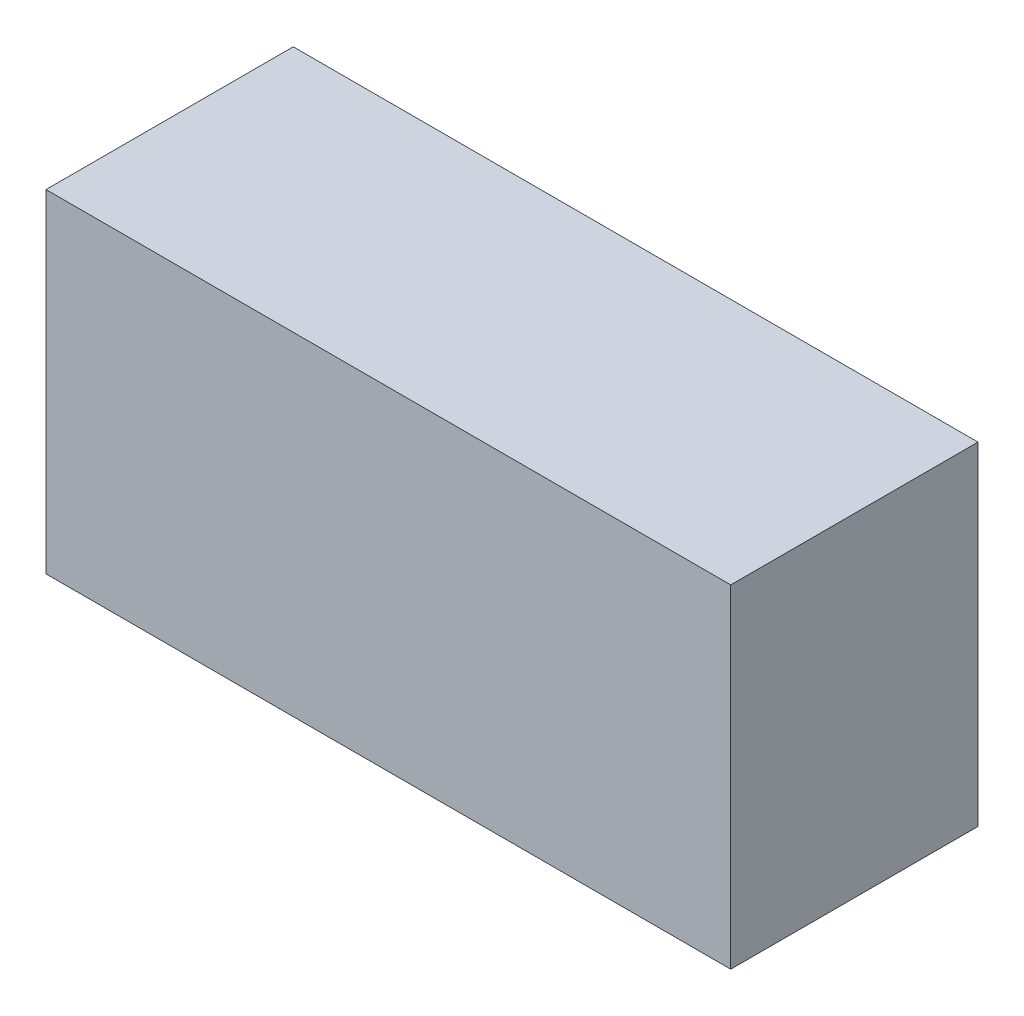
from build123d import *

# Parameters (mm, degrees)
SKETCH1_W           = 72
SKETCH1_H           = 26
BOSS_EXTRUDE1_DEPTH = 35
SKETCH2_W           = 0.448717948
SKETCH2_H           = 3.653846154
BOSS_EXTRUDE2_DEPTH = 1


with BuildPart() as part:
    # Sketch1 → Boss-Extrude1 (new body)
    with BuildSketch(Plane(origin=(0, 0, 0), x_dir=(1, 0, 0), z_dir=(0, 1, 0))):
        Rectangle(SKETCH1_W, SKETCH1_H)
    extrude(amount=BOSS_EXTRUDE1_DEPTH)

    # Sketch2 → Boss-Extrude2 (add)
    # profile 1 of 13: a face of its own
    with BuildSketch(Plane(origin=(0, 22.5, -13), x_dir=(1, 0, 0), z_dir=(0, 0, 1))):
        with BuildLine():
            Line((-20.801282051, -8.732744121), (-19.825721154, -8.732744121))
            add(Edge.make_bspline(
                [(-19.825721154, -8.732744121), (-19.777965432, -8.732497002), (-19.685402957, -8.732018023), (-19.55081399, -8.724416976), (-19.424708804, -8.714312102), (-19.307310244, -8.697361721), (-19.197854414, -8.679786411), (-19.097452521, -8.653990064), (-19.005263574, -8.625497059), (-18.894563518, -8.581656703), (-18.768959137, -8.513572079), (-18.633957929, -8.412596111), (-18.516606641, -8.291534079), (-18.416823262, -8.153574345), (-18.336744978, -8.001803004), (-18.279544786, -7.839485465), (-18.242797204, -7.669352527), (-18.239065454, -7.552710667), (-18.237179487, -7.493761749)],
                knots=[0, 0, 0, 0, 1.00128172, 1.940733171, 2.826250472, 3.653024905, 4.427672124, 5.149348099, 5.824709082, 6.450061444, 7.643590664, 8.808605388, 9.972104426, 11.165284501, 12.367876273, 13.557044126, 14.765369432, 16, 16, 16, 16], degree=3))
            add(Edge.make_bspline(
                [(-18.237179487, -7.493761749), (-18.238719971, -7.438536761), (-18.241747167, -7.330014451), (-18.271320427, -7.171820125), (-18.315960546, -7.020758725), (-18.380378948, -6.878286023), (-18.462517825, -6.745653922), (-18.56245211, -6.625124791), (-18.680946784, -6.519065009), (-18.769913239, -6.460041231), (-18.815104167, -6.430059826)],
                knots=[0, 0, 0, 0, 1.044356178, 2.052258378, 3.035953355, 4.020338374, 5.002448483, 5.980768927, 6.974322109, 8, 8, 8, 8], degree=3))
            add(Edge.make_bspline(
                [(-18.815104167, -6.430059826), (-18.758299525, -6.408262462), (-18.649618173, -6.366558706), (-18.499865057, -6.292541381), (-18.370799058, -6.212653289), (-18.260756867, -6.12630887), (-18.168549286, -6.030688738), (-18.08640707, -5.928311111), (-18.016695497, -5.815610524), (-17.957215972, -5.695029146), (-17.910098737, -5.56720553), (-17.877392824, -5.43309595), (-17.85665063, -5.294219381), (-17.85393821, -5.199831624), (-17.852564103, -5.152014954)],
                knots=[0, 0, 0, 0, 1.272200328, 2.434034374, 3.488177493, 4.442517805, 5.351202203, 6.260825393, 7.183200622, 8.11705787, 9.069326169, 10.026320267, 11.000137371, 12, 12, 12, 12], degree=3))
            add(Edge.make_bspline(
                [(-17.852564103, -5.152014954), (-17.853959731, -5.103205218), (-17.856705669, -5.007170695), (-17.876960858, -4.866090772), (-17.911266613, -4.731273681), (-17.958485239, -4.601822025), (-18.020037095, -4.478493963), (-18.094398133, -4.360320272), (-18.183647062, -4.249052306), (-18.284150135, -4.143075428), (-18.396282649, -4.046164152), (-18.519843907, -3.962881788), (-18.651667161, -3.890947386), (-18.793557574, -3.833116162), (-18.944508337, -3.787844891), (-19.104554812, -3.756544409), (-19.273606118, -3.735369437), (-19.389621732, -3.733634075), (-19.44911859, -3.732744121)],
                knots=[0, 0, 0, 0, 0.978522333, 1.925270105, 2.85076145, 3.763600118, 4.682725947, 5.609499657, 6.557784645, 7.537954401, 8.534920712, 9.522742111, 10.520247711, 11.5409147, 12.58930695, 13.675078472, 14.807699069, 16, 16, 16, 16], degree=3))
            Line((-19.44911859, -3.732744121), (-20.801282051, -3.732744121))
            Line((-20.801282051, -3.732744121), (-20.801282051, -8.732744121))
        make_face()
        with BuildLine():
            Line((-20.352564103, -8.219923608), (-20.352564103, -6.617359506))
            Line((-20.352564103, -6.617359506), (-20.051081731, -6.617359506))
            add(Edge.make_bspline(
                [(-20.051081731, -6.617359506), (-20.007011626, -6.61792607), (-19.921859203, -6.619020787), (-19.79821736, -6.622255472), (-19.683735472, -6.630916093), (-19.578019079, -6.640076146), (-19.481776658, -6.654180692), (-19.39468628, -6.671440877), (-19.31596474, -6.689534948), (-19.225225478, -6.72039563), (-19.122311596, -6.765527064), (-19.013370616, -6.837282489), (-18.915318838, -6.920359757), (-18.83443178, -7.01890238), (-18.767090369, -7.1253195), (-18.721752011, -7.240404674), (-18.690140423, -7.360192035), (-18.687326253, -7.442803595), (-18.685897436, -7.484747326)],
                knots=[0, 0, 0, 0, 1.156584208, 2.234756387, 3.244705828, 4.168772894, 5.018724976, 5.795346628, 6.498686023, 7.135894168, 8.308330183, 9.43588092, 10.547699294, 11.667188675, 12.76860303, 13.837480448, 14.902040606, 16, 16, 16, 16], degree=3))
            add(Edge.make_bspline(
                [(-18.685897436, -7.484747326), (-18.686594293, -7.512514992), (-18.687961254, -7.5669843), (-18.700848136, -7.646342954), (-18.718631881, -7.72186103), (-18.747961705, -7.791502695), (-18.782709966, -7.857713352), (-18.827248936, -7.918401534), (-18.878606466, -7.975211289), (-18.93848291, -8.026619886), (-19.006633504, -8.073115995), (-19.085217099, -8.111821785), (-19.172097197, -8.14621915), (-19.269085521, -8.172293157), (-19.374250151, -8.194929547), (-19.489195527, -8.209203929), (-19.613228908, -8.218374017), (-19.699166909, -8.219395557), (-19.743589744, -8.219923608)],
                knots=[0, 0, 0, 0, 0.911412742, 1.787835618, 2.63643285, 3.453173233, 4.262886967, 5.08783453, 5.918594724, 6.773969545, 7.67442701, 8.62112486, 9.645634318, 10.739428598, 11.916091468, 13.177237585, 14.540865421, 16, 16, 16, 16], degree=3))
            Line((-19.743589744, -8.219923608), (-20.352564103, -8.219923608))
        make_face(mode=Mode.SUBTRACT)
        with BuildLine():
            Line((-20.352564103, -6.104538993), (-20.352564103, -4.245564634))
            Line((-20.352564103, -4.245564634), (-19.713541667, -4.245564634))
            add(Edge.make_bspline(
                [(-19.713541667, -4.245564634), (-19.667804917, -4.246165559), (-19.57965336, -4.247323763), (-19.452280831, -4.250072021), (-19.334853106, -4.260268048), (-19.22639248, -4.27004337), (-19.127400787, -4.286013389), (-19.036915165, -4.301477878), (-18.957002347, -4.324234638), (-18.863499735, -4.355548341), (-18.758918004, -4.40559179), (-18.644709819, -4.479184969), (-18.544116164, -4.568826883), (-18.458769497, -4.672044459), (-18.387807485, -4.783115208), (-18.338715787, -4.902257738), (-18.306907162, -5.025492494), (-18.303160863, -5.1097559), (-18.301282051, -5.152014954)],
                knots=[0, 0, 0, 0, 1.16016216, 2.236059617, 3.229676189, 4.14889023, 4.996733752, 5.772278665, 6.474820656, 7.101410824, 8.271817372, 9.403828207, 10.537358096, 11.673541442, 12.791884111, 13.865947414, 14.929748409, 16, 16, 16, 16], degree=3))
            add(Edge.make_bspline(
                [(-18.301282051, -5.152014954), (-18.301665574, -5.178437975), (-18.302426434, -5.23085781), (-18.314386394, -5.307822638), (-18.330983759, -5.382745713), (-18.355443612, -5.454609329), (-18.385033384, -5.524650966), (-18.424069833, -5.590591599), (-18.468102658, -5.655238215), (-18.536302844, -5.737928395), (-18.636853318, -5.832051394), (-18.779789365, -5.92305217), (-18.94140392, -5.997630142), (-19.058897301, -6.029157977), (-19.119591346, -6.045444442)],
                knots=[0, 0, 0, 0, 0.723354195, 1.435040621, 2.129761981, 2.824182007, 3.512608497, 4.209435533, 4.920062464, 5.654614313, 7.143585817, 8.671381114, 10.280521501, 12, 12, 12, 12], degree=3))
            add(Edge.make_bspline(
                [(-19.119591346, -6.045444442), (-19.143918603, -6.050380608), (-19.196665114, -6.061083234), (-19.282676381, -6.072373573), (-19.381199742, -6.082501375), (-19.491814094, -6.089796221), (-19.614959362, -6.097627112), (-19.750595985, -6.100564173), (-19.898819854, -6.104149012), (-20.001666226, -6.104405674), (-20.055088141, -6.104538993)],
                knots=[0, 0, 0, 0, 0.634452549, 1.375623993, 2.216454381, 3.166361212, 4.209414599, 5.370755378, 6.634280627, 8, 8, 8, 8], degree=3))
            Line((-20.055088141, -6.104538993), (-20.352564103, -6.104538993))
        make_face(mode=Mode.SUBTRACT)
    # profile 2 of 13: a face of its own
    with BuildSketch(Plane(origin=(0, 22.5, -13), x_dir=(1, 0, 0), z_dir=(0, 0, 1))):
        with BuildLine():
            Line((-13.237179487, -7.386590275), (-13.237179487, -3.732744121))
            Line((-13.237179487, -3.732744121), (-13.685897436, -3.732744121))
            Line((-13.685897436, -3.732744121), (-13.685897436, -4.364755339))
            add(Edge.make_bspline(
                [(-13.685897436, -4.364755339), (-13.736564258, -4.307634786), (-13.835588238, -4.195997537), (-13.999392659, -4.049253034), (-14.174459716, -3.92944337), (-14.357806814, -3.832193631), (-14.550853122, -3.758884938), (-14.752464887, -3.707239872), (-14.962484365, -3.673644023), (-15.105706266, -3.670324006), (-15.178285256, -3.668641557)],
                knots=[0, 0, 0, 0, 1.074235403, 2.099501444, 3.086304576, 4.053325556, 5.01427503, 5.985443889, 6.979105517, 8, 8, 8, 8], degree=3))
            add(Edge.make_bspline(
                [(-15.178285256, -3.668641557), (-15.24281108, -3.670393227), (-15.370058861, -3.673847597), (-15.557240736, -3.700655068), (-15.737381831, -3.743683377), (-15.910596954, -3.803598605), (-16.07571243, -3.882664006), (-16.233658642, -3.978344062), (-16.384804208, -4.09116775), (-16.526274655, -4.220651516), (-16.656713913, -4.361140552), (-16.77083509, -4.511421179), (-16.867556502, -4.669429298), (-16.94704418, -4.835120498), (-17.008555914, -5.00837366), (-17.051351437, -5.189069927), (-17.07813002, -5.376908632), (-17.08158264, -5.504822782), (-17.083333333, -5.569683224)],
                knots=[0, 0, 0, 0, 1.034036272, 2.039165313, 3.024406509, 3.999331371, 4.971254918, 5.953351348, 6.95522652, 7.989525907, 9.023492927, 10.024309745, 11.009187477, 11.988246066, 12.964946762, 13.950187958, 14.960617622, 16, 16, 16, 16], degree=3))
            add(Edge.make_bspline(
                [(-17.083333333, -5.569683224), (-17.08154381, -5.633203071), (-17.07800602, -5.758778382), (-17.051637976, -5.943458324), (-17.007331225, -6.121355998), (-16.945033841, -6.291812406), (-16.865503893, -6.455514031), (-16.767119091, -6.61118007), (-16.653039039, -6.761191775), (-16.521205715, -6.900738535), (-16.378465519, -7.029171783), (-16.226474309, -7.142269654), (-16.067127263, -7.237704395), (-15.900104868, -7.315283562), (-15.72658979, -7.37693269), (-15.545263928, -7.419908069), (-15.356951879, -7.445170712), (-15.229109663, -7.448834443), (-15.164262821, -7.450692839)],
                knots=[0, 0, 0, 0, 1.02050356, 2.017480486, 2.990790918, 3.96161403, 4.928589988, 5.909588639, 6.91611943, 7.952353252, 8.989586576, 9.99823133, 10.991940466, 11.968822692, 12.952985106, 13.945868367, 14.958059758, 16, 16, 16, 16], degree=3))
            add(Edge.make_bspline(
                [(-15.164262821, -7.450692839), (-15.089690105, -7.44864662), (-14.94345653, -7.444634081), (-14.72926166, -7.410956751), (-14.526537561, -7.354588066), (-14.333528326, -7.27765062), (-14.152946359, -7.17404326), (-13.983055652, -7.045846169), (-13.82587202, -6.889951432), (-13.733362755, -6.771357547), (-13.685897436, -6.710508544)],
                knots=[0, 0, 0, 0, 1.038908319, 2.037250181, 3.012632028, 3.966567879, 4.9252131, 5.905168122, 6.925168603, 8, 8, 8, 8], degree=3))
            Line((-13.685897436, -6.710508544), (-13.685897436, -7.386590275))
            Line((-13.685897436, -7.386590275), (-13.237179487, -7.386590275))
        make_face()
        with BuildLine():
            add(Edge.make_bspline(
                [(-15.158253205, -7.00197489), (-15.223843744, -6.99963915), (-15.353309036, -6.99502877), (-15.543391739, -6.959095155), (-15.72519348, -6.899152848), (-15.898418617, -6.817647231), (-16.058284717, -6.713241051), (-16.203530503, -6.590138068), (-16.33021861, -6.446830036), (-16.43733697, -6.286609481), (-16.52626506, -6.115875015), (-16.587632349, -5.936096795), (-16.628392781, -5.752133863), (-16.632535783, -5.627324128), (-16.634615385, -5.564675211)],
                knots=[0, 0, 0, 0, 1.031179624, 2.035384561, 3.030098214, 4.035455833, 5.037557836, 6.024646278, 7.02156144, 8.035264006, 9.049836703, 10.039645228, 11.015989397, 12, 12, 12, 12], degree=3))
            add(Edge.make_bspline(
                [(-16.634615385, -5.564675211), (-16.631915805, -5.502416002), (-16.626527226, -5.37814162), (-16.588884569, -5.193896772), (-16.522810796, -5.015291463), (-16.43582797, -4.842356149), (-16.32702343, -4.680940522), (-16.200585368, -4.534986384), (-16.054602577, -4.409985773), (-15.893328758, -4.305284495), (-15.721262477, -4.22106073), (-15.540250042, -4.161657441), (-15.353446442, -4.124150725), (-15.226202925, -4.11963086), (-15.162259615, -4.117359506)],
                knots=[0, 0, 0, 0, 0.979235476, 1.954632679, 2.943119654, 3.967171814, 4.992637064, 5.997548408, 6.995574264, 8.005058949, 9.015076297, 9.999929117, 10.994910263, 12, 12, 12, 12], degree=3))
            add(Edge.make_bspline(
                [(-15.162259615, -4.117359506), (-15.097337074, -4.119722612), (-14.968540978, -4.124410644), (-14.777801023, -4.160592075), (-14.593040475, -4.221278678), (-14.415763999, -4.303915907), (-14.250896516, -4.406365971), (-14.103614019, -4.526838083), (-13.976376107, -4.664801168), (-13.871616656, -4.819430861), (-13.787915269, -4.987081428), (-13.728648339, -5.166148512), (-13.692651692, -5.355568031), (-13.688179985, -5.485388499), (-13.685897436, -5.551654377)],
                knots=[0, 0, 0, 0, 1.017730373, 2.019016736, 3.032373701, 4.060729657, 5.079187105, 6.068726676, 7.03591854, 8.011858086, 8.988317194, 9.965225429, 10.961364673, 12, 12, 12, 12], degree=3))
            add(Edge.make_bspline(
                [(-13.685897436, -5.551654377), (-13.687268395, -5.602136973), (-13.689966877, -5.701502697), (-13.710581667, -5.847399429), (-13.743375552, -5.987018018), (-13.789580242, -6.120511283), (-13.850297414, -6.247118943), (-13.923450707, -6.367833429), (-14.010540604, -6.481530299), (-14.108916737, -6.588065568), (-14.217812495, -6.684750345), (-14.33360902, -6.769967496), (-14.45601497, -6.842084655), (-14.584944422, -6.899797245), (-14.719404352, -6.946814245), (-14.860683535, -6.977868161), (-15.007358133, -6.999259517), (-15.107425259, -7.001060236), (-15.158253205, -7.00197489)],
                knots=[0, 0, 0, 0, 1.050062701, 2.066855696, 3.059271411, 4.030305351, 4.999747758, 5.975466543, 6.961907836, 7.974539719, 8.98812422, 9.98710676, 10.961662635, 11.93785114, 12.922015094, 13.919620009, 14.94329489, 16, 16, 16, 16], degree=3))
        make_face(mode=Mode.SUBTRACT)
    # profile 3 of 13: a face of its own
    with BuildSketch(Plane(origin=(0, 22.5, -13), x_dir=(1, 0, 0), z_dir=(0, 0, 1))):
        Polygon((-11.762820513, -8.860949249), (-11.314102564, -8.860949249), (-11.314102564, -7.386590275), (-10.673076923, -7.386590275), (-10.673076923, -6.937872326), (-11.314102564, -6.937872326), (-11.314102564, -3.732744121), (-11.762820513, -3.732744121), (-11.762820513, -6.937872326), (-12.403846154, -6.937872326), (-12.403846154, -7.386590275), (-11.762820513, -7.386590275), align=None)
    # profile 4 of 13: a face of its own
    with BuildSketch(Plane(origin=(0, 22.5, -13), x_dir=(1, 0, 0), z_dir=(0, 0, 1))):
        with BuildLine():
            Line((-6.840945513, -4.886590275), (-6.442307692, -4.677255339))
            add(Edge.make_bspline(
                [(-6.442307692, -4.677255339), (-6.4740955, -4.620925695), (-6.535941984, -4.511330515), (-6.64178892, -4.360675656), (-6.753897771, -4.226415677), (-6.87449646, -4.109180861), (-7.002072112, -4.006217171), (-7.138524589, -3.917992467), (-7.281583406, -3.841392671), (-7.433323591, -3.778959659), (-7.593600362, -3.729818071), (-7.763401118, -3.693542469), (-7.943511609, -3.67250231), (-8.066851664, -3.669948987), (-8.130008013, -3.668641557)],
                knots=[0, 0, 0, 0, 1.120547187, 2.180141081, 3.186367408, 4.148075574, 5.090720713, 6.023293347, 6.960451315, 7.899733127, 8.862572377, 9.862522039, 10.90550313, 12, 12, 12, 12], degree=3))
            add(Edge.make_bspline(
                [(-8.130008013, -3.668641557), (-8.200210837, -3.670280379), (-8.33715621, -3.673477246), (-8.536498712, -3.701037907), (-8.724183574, -3.745998428), (-8.90020037, -3.808806314), (-9.064117597, -3.89084546), (-9.216262702, -3.990787161), (-9.357429563, -4.108120528), (-9.483193206, -4.243852326), (-9.596343942, -4.389134449), (-9.696436084, -4.540419812), (-9.77914708, -4.697644623), (-9.849744189, -4.858421796), (-9.901979781, -5.024891124), (-9.940978501, -5.195585926), (-9.962829682, -5.37113129), (-9.966233434, -5.489832815), (-9.967948718, -5.549651172)],
                knots=[0, 0, 0, 0, 1.145213001, 2.233978795, 3.276616913, 4.289988888, 5.2768102, 6.260573508, 7.254647871, 8.264498533, 9.273731702, 10.25749501, 11.220258744, 12.169609138, 13.119022067, 14.062790212, 15.023763961, 16, 16, 16, 16], degree=3))
            add(Edge.make_bspline(
                [(-9.967948718, -5.549651172), (-9.966435659, -5.605786644), (-9.963436976, -5.717039737), (-9.944535851, -5.8817048), (-9.911038289, -6.041745447), (-9.865072112, -6.197294658), (-9.805713189, -6.348091993), (-9.733095733, -6.494229226), (-9.647106622, -6.635550855), (-9.580717088, -6.724698189), (-9.547275641, -6.769603095)],
                knots=[0, 0, 0, 0, 1.024358464, 2.0301432, 3.019427413, 4.004406732, 4.986367066, 5.972626655, 6.978780325, 8, 8, 8, 8], degree=3))
            add(Edge.make_bspline(
                [(-9.547275641, -6.769603095), (-9.502057042, -6.82379118), (-9.413197504, -6.930276747), (-9.261344989, -7.068919352), (-9.099131017, -7.187516249), (-8.924923911, -7.284267832), (-8.739017113, -7.358685096), (-8.542369515, -7.411617112), (-8.334437589, -7.44455383), (-8.191897979, -7.448615391), (-8.118990385, -7.450692839)],
                knots=[0, 0, 0, 0, 1.030811313, 2.025658015, 2.997072178, 3.962767568, 4.930766827, 5.917075773, 6.934604948, 8, 8, 8, 8], degree=3))
            add(Edge.make_bspline(
                [(-8.118990385, -7.450692839), (-8.044060926, -7.448768172), (-7.897066409, -7.444992413), (-7.682795678, -7.409675053), (-7.479650098, -7.354348288), (-7.289306124, -7.273739817), (-7.108830837, -7.173820112), (-6.942377854, -7.047526283), (-6.785377933, -6.90134493), (-6.694089526, -6.788808064), (-6.647636218, -6.731542198)],
                knots=[0, 0, 0, 0, 1.056389096, 2.072394598, 3.055233004, 4.020130009, 4.981825462, 5.957811105, 6.960805292, 8, 8, 8, 8], degree=3))
            add(Edge.make_bspline(
                [(-6.647636218, -6.731542198), (-6.616026306, -6.688394225), (-6.553016887, -6.602385484), (-6.474092459, -6.462140973), (-6.405581894, -6.315411553), (-6.350820522, -6.159825414), (-6.306478377, -5.997226014), (-6.274397207, -5.82645095), (-6.255583467, -5.647551077), (-6.251885328, -5.525655998), (-6.25, -5.463513352)],
                knots=[0, 0, 0, 0, 0.94817472, 1.890038105, 2.849395472, 3.817997239, 4.812318967, 5.836947057, 6.897266129, 8, 8, 8, 8], degree=3))
            Line((-6.25, -5.463513352), (-9.519230769, -5.463513352))
            add(Edge.make_bspline(
                [(-9.519230769, -5.463513352), (-9.517029243, -5.415370805), (-9.51270003, -5.320700429), (-9.492565227, -5.182156899), (-9.460673687, -5.050245134), (-9.416343521, -4.92552718), (-9.360758066, -4.807593545), (-9.294807504, -4.695631445), (-9.215645918, -4.591341236), (-9.127496499, -4.493371449), (-9.029330066, -4.406157958), (-8.926092057, -4.328037327), (-8.81642745, -4.262923558), (-8.701441762, -4.209274822), (-8.580538667, -4.16798316), (-8.453888188, -4.139548319), (-8.32188431, -4.120552414), (-8.231905597, -4.118436639), (-8.186097756, -4.117359506)],
                knots=[0, 0, 0, 0, 1.094405546, 2.152104367, 3.174987145, 4.173015398, 5.153654967, 6.133208507, 7.119289451, 8.123438607, 9.122504012, 10.097966803, 11.060604936, 12.014205423, 12.976096155, 13.956823727, 14.959826266, 16, 16, 16, 16], degree=3))
            add(Edge.make_bspline(
                [(-8.186097756, -4.117359506), (-8.141307306, -4.118215116), (-8.05243446, -4.119912812), (-7.919811166, -4.136906418), (-7.789031068, -4.163392661), (-7.661789986, -4.20182404), (-7.540125642, -4.247274809), (-7.426508182, -4.300417433), (-7.322004495, -4.360315783), (-7.224518248, -4.429444303), (-7.130475021, -4.513403629), (-7.036885586, -4.618374461), (-6.937433125, -4.74326308), (-6.874318357, -4.837016697), (-6.840945513, -4.886590275)],
                knots=[0, 0, 0, 0, 0.991026944, 1.966387566, 2.954903586, 3.941705208, 4.905318989, 5.827751054, 6.715113263, 7.568237245, 8.468614997, 9.499196909, 10.677664282, 12, 12, 12, 12], degree=3))
        make_face()
        with BuildLine():
            add(Edge.make_bspline(
                [(-6.698717949, -5.912231301), (-6.71504728, -5.971793648), (-6.74639429, -6.086134006), (-6.81357493, -6.244042072), (-6.885725776, -6.385996072), (-6.974329005, -6.508406451), (-7.074600777, -6.61654382), (-7.190779685, -6.71047453), (-7.319027539, -6.796633269), (-7.461675877, -6.868457338), (-7.613211419, -6.92745868), (-7.77048798, -6.970848139), (-7.93219684, -6.996352573), (-8.04111137, -7.000091975), (-8.095953526, -7.00197489)],
                knots=[0, 0, 0, 0, 1.154958961, 2.217145986, 3.207012531, 4.129872728, 5.036522214, 5.960144231, 6.920619777, 7.92424629, 8.943461387, 9.961007416, 10.973298156, 12, 12, 12, 12], degree=3))
            add(Edge.make_bspline(
                [(-8.095953526, -7.00197489), (-8.140740592, -7.001107527), (-8.229275207, -6.999392931), (-8.359674175, -6.982913799), (-8.485454754, -6.95608248), (-8.606013957, -6.917692771), (-8.721624101, -6.869420037), (-8.832815622, -6.81132417), (-8.938250166, -6.740636589), (-9.004161677, -6.686683646), (-9.037459936, -6.659426813)],
                knots=[0, 0, 0, 0, 1.04879286, 2.073242986, 3.073461291, 4.057960153, 5.032623303, 6.005244481, 6.992256684, 8, 8, 8, 8], degree=3))
            add(Edge.make_bspline(
                [(-9.037459936, -6.659426813), (-9.061311219, -6.637865772), (-9.109580403, -6.594231478), (-9.174008528, -6.519011523), (-9.236156228, -6.437853596), (-9.291383515, -6.347215078), (-9.343868853, -6.249724388), (-9.391696604, -6.144670161), (-9.43518381, -6.031608959), (-9.459595813, -5.952785084), (-9.472155449, -5.912231301)],
                knots=[0, 0, 0, 0, 0.879905587, 1.780714457, 2.708106151, 3.677566983, 4.684151534, 5.740052498, 6.837288539, 8, 8, 8, 8], degree=3))
            Line((-9.472155449, -5.912231301), (-6.698717949, -5.912231301))
        make_face(mode=Mode.SUBTRACT)
    # profile 5 of 13: a face of its own
    with BuildSketch(Plane(origin=(0, 22.5, -13), x_dir=(1, 0, 0), z_dir=(0, 0, 1))):
        with BuildLine():
            Line((-5.480769231, -7.386590275), (-5.032051282, -7.386590275))
            Line((-5.032051282, -7.386590275), (-5.032051282, -6.848729698))
            add(Edge.make_bspline(
                [(-5.032051282, -6.848729698), (-4.998949652, -6.898837105), (-4.935643041, -6.994667132), (-4.82986312, -7.121157168), (-4.722701136, -7.227553408), (-4.610511537, -7.310308486), (-4.496147338, -7.373370694), (-4.379946861, -7.418063435), (-4.261071521, -7.44530517), (-4.180827622, -7.448894544), (-4.140625, -7.450692839)],
                knots=[0, 0, 0, 0, 1.280240866, 2.448450709, 3.511242029, 4.49418232, 5.41222037, 6.289222348, 7.142891256, 8, 8, 8, 8], degree=3))
            add(Edge.make_bspline(
                [(-4.140625, -7.450692839), (-4.109434431, -7.449030135), (-4.045582668, -7.44562633), (-3.948631075, -7.420514332), (-3.848329342, -7.381942943), (-3.783602631, -7.344783635), (-3.75, -7.325492519)],
                knots=[0, 0, 0, 0, 0.90119973, 1.844890732, 2.881183062, 4, 4, 4, 4], degree=3))
            Line((-3.75, -7.325492519), (-3.996394231, -6.936870724))
            add(Edge.make_bspline(
                [(-3.996394231, -6.936870724), (-4.017978547, -6.946499675), (-4.05894971, -6.964777269), (-4.118884805, -6.986408712), (-4.174143857, -6.999145734), (-4.209348941, -7.001075331), (-4.225761218, -7.00197489)],
                knots=[0, 0, 0, 0, 1.180555205, 2.24091978, 3.179933427, 4, 4, 4, 4], degree=3))
            add(Edge.make_bspline(
                [(-4.225761218, -7.00197489), (-4.262142061, -6.999682083), (-4.335685631, -6.995047191), (-4.443143162, -6.955446807), (-4.548811139, -6.895929947), (-4.630875561, -6.825724932), (-4.695126385, -6.759572667), (-4.741363332, -6.701359025), (-4.782889286, -6.635523907), (-4.823162149, -6.564561011), (-4.86058103, -6.486704193), (-4.894019634, -6.401822173), (-4.925291366, -6.310617112), (-4.942902131, -6.247200055), (-4.951923077, -6.214715275)],
                knots=[0, 0, 0, 0, 1.1355652, 2.295535532, 3.545064593, 4.917862323, 5.656949634, 6.430545574, 7.239270929, 8.090880714, 8.983622437, 9.940313733, 10.94494545, 12, 12, 12, 12], degree=3))
            add(Edge.make_bspline(
                [(-4.951923077, -6.214715275), (-4.958695323, -6.185749488), (-4.973770553, -6.121270741), (-4.988036829, -6.013588741), (-5.002700234, -5.886447845), (-5.012713863, -5.739700354), (-5.022173071, -5.572782166), (-5.027398728, -5.386413367), (-5.03188502, -5.180081719), (-5.031994093, -5.036166204), (-5.032051282, -4.960708865)],
                knots=[0, 0, 0, 0, 0.566841273, 1.261806378, 2.068780918, 3.007109044, 4.065315289, 5.256255371, 6.561408263, 8, 8, 8, 8], degree=3))
            Line((-5.032051282, -4.960708865), (-5.032051282, -3.732744121))
            Line((-5.032051282, -3.732744121), (-5.480769231, -3.732744121))
            Line((-5.480769231, -3.732744121), (-5.480769231, -7.386590275))
        make_face()
    # profile 6 of 13: a face of its own
    with BuildSketch(Plane(origin=(0, 22.5, -13), x_dir=(1, 0, 0), z_dir=(0, 0, 1))):
        with BuildLine():
            add(Edge.make_bspline(
                [(-3.143028846, -8.925051813), (-3.115188758, -8.923754564), (-3.06067252, -8.921214301), (-2.981758958, -8.899634631), (-2.909974963, -8.862497812), (-2.845354118, -8.814293315), (-2.791786409, -8.755271717), (-2.75337551, -8.688210136), (-2.728854109, -8.615203164), (-2.725875519, -8.564333462), (-2.724358974, -8.538433224)],
                knots=[0, 0, 0, 0, 1.054986045, 2.065865298, 3.074122704, 4.105114675, 5.109626121, 6.074217918, 7.019490725, 8, 8, 8, 8], degree=3))
            add(Edge.make_bspline(
                [(-2.724358974, -8.538433224), (-2.725909445, -8.513205275), (-2.728974543, -8.463332606), (-2.753357383, -8.391591483), (-2.792108439, -8.325463719), (-2.845318464, -8.266557513), (-2.909984379, -8.218380864), (-2.981756467, -8.181236688), (-3.060673175, -8.159658961), (-3.11518898, -8.15711843), (-3.143028846, -8.155821044)],
                knots=[0, 0, 0, 0, 0.961106377, 1.899993565, 2.859409042, 3.870007927, 4.90724781, 5.921615355, 6.938620636, 8, 8, 8, 8], degree=3))
            add(Edge.make_bspline(
                [(-3.143028846, -8.155821044), (-3.170548965, -8.157076763), (-3.224113281, -8.159520854), (-3.301575855, -8.181494846), (-3.37220482, -8.218300091), (-3.435768871, -8.267224213), (-3.490033861, -8.325072032), (-3.528641937, -8.391641433), (-3.553089968, -8.463319888), (-3.556146281, -8.513201003), (-3.557692308, -8.538433224)],
                knots=[0, 0, 0, 0, 1.055304112, 2.054011575, 3.063363921, 4.096942562, 5.122536081, 6.088009498, 7.032825006, 8, 8, 8, 8], degree=3))
            add(Edge.make_bspline(
                [(-3.557692308, -8.538433224), (-3.556180372, -8.564337896), (-3.553210835, -8.615216308), (-3.528622961, -8.688159331), (-3.490359864, -8.755666746), (-3.435733809, -8.813627098), (-3.372213999, -8.862578407), (-3.301573464, -8.899376542), (-3.224113915, -8.921352393), (-3.17054918, -8.923796227), (-3.143028846, -8.925051813)],
                knots=[0, 0, 0, 0, 0.986662878, 1.937868148, 2.908513651, 3.927890639, 4.955204348, 5.958438607, 6.951092507, 8, 8, 8, 8], degree=3))
        make_face()
    # profile 7 of 13: a face of its own
    with BuildSketch(Plane(origin=(0, 22.5, -13), x_dir=(1, 0, 0), z_dir=(0, 0, 1))):
        with Locations((-3.141025641, -5.559667198)):
            Rectangle(SKETCH2_W, SKETCH2_H)
    # profile 8 of 13: a face of its own
    with BuildSketch(Plane(origin=(0, 22.5, -13), x_dir=(1, 0, 0), z_dir=(0, 0, 1))):
        with BuildLine():
            Line((1.826923077, -7.386590275), (1.826923077, -3.732744121))
            Line((1.826923077, -3.732744121), (1.378205128, -3.732744121))
            Line((1.378205128, -3.732744121), (1.378205128, -4.364755339))
            add(Edge.make_bspline(
                [(1.378205128, -4.364755339), (1.327538307, -4.307634786), (1.228514326, -4.195997537), (1.064709905, -4.049253034), (0.889642848, -3.92944337), (0.70629575, -3.832193631), (0.513249443, -3.758884938), (0.311637677, -3.707239872), (0.101618199, -3.673644023), (-0.041603702, -3.670324006), (-0.114182692, -3.668641557)],
                knots=[0, 0, 0, 0, 1.074235403, 2.099501444, 3.086304576, 4.053325556, 5.01427503, 5.985443889, 6.979105517, 8, 8, 8, 8], degree=3))
            add(Edge.make_bspline(
                [(-0.114182692, -3.668641557), (-0.178708516, -3.670393227), (-0.305956297, -3.673847597), (-0.493138172, -3.700655068), (-0.673279267, -3.743683377), (-0.84649439, -3.803598605), (-1.011609866, -3.882664006), (-1.169556078, -3.978344062), (-1.320701644, -4.09116775), (-1.462172091, -4.220651516), (-1.592611349, -4.361140552), (-1.706732525, -4.511421179), (-1.803453938, -4.669429298), (-1.882941616, -4.835120498), (-1.94445335, -5.00837366), (-1.987248873, -5.189069927), (-2.014027456, -5.376908632), (-2.017480076, -5.504822782), (-2.019230769, -5.569683224)],
                knots=[0, 0, 0, 0, 1.034036272, 2.039165313, 3.024406509, 3.999331371, 4.971254918, 5.953351348, 6.95522652, 7.989525907, 9.023492927, 10.024309745, 11.009187477, 11.988246066, 12.964946762, 13.950187958, 14.960617622, 16, 16, 16, 16], degree=3))
            add(Edge.make_bspline(
                [(-2.019230769, -5.569683224), (-2.017441246, -5.633203071), (-2.013903455, -5.758778382), (-1.987535412, -5.943458324), (-1.943228661, -6.121355998), (-1.880931277, -6.291812406), (-1.801401329, -6.455514031), (-1.703016527, -6.61118007), (-1.588936475, -6.761191775), (-1.457103151, -6.900738535), (-1.314362955, -7.029171783), (-1.162371745, -7.142269654), (-1.003024699, -7.237704395), (-0.836002304, -7.315283562), (-0.662487226, -7.37693269), (-0.481161364, -7.419908069), (-0.292849315, -7.445170712), (-0.165007099, -7.448834443), (-0.100160256, -7.450692839)],
                knots=[0, 0, 0, 0, 1.02050356, 2.017480486, 2.990790918, 3.96161403, 4.928589988, 5.909588639, 6.91611943, 7.952353252, 8.989586576, 9.99823133, 10.991940466, 11.968822692, 12.952985106, 13.945868367, 14.958059758, 16, 16, 16, 16], degree=3))
            add(Edge.make_bspline(
                [(-0.100160256, -7.450692839), (-0.025587541, -7.44864662), (0.120646034, -7.444634081), (0.334840904, -7.410956751), (0.537565003, -7.354588066), (0.730574239, -7.27765062), (0.911156205, -7.17404326), (1.081046913, -7.045846169), (1.238230545, -6.889951432), (1.33073981, -6.771357547), (1.378205128, -6.710508544)],
                knots=[0, 0, 0, 0, 1.038908319, 2.037250181, 3.012632028, 3.966567879, 4.9252131, 5.905168122, 6.925168603, 8, 8, 8, 8], degree=3))
            Line((1.378205128, -6.710508544), (1.378205128, -7.386590275))
            Line((1.378205128, -7.386590275), (1.826923077, -7.386590275))
        make_face()
        with BuildLine():
            add(Edge.make_bspline(
                [(-0.094150641, -7.00197489), (-0.15974118, -6.99963915), (-0.289206472, -6.99502877), (-0.479289175, -6.959095155), (-0.661090916, -6.899152848), (-0.834316053, -6.817647231), (-0.994182153, -6.713241051), (-1.139427939, -6.590138068), (-1.266116046, -6.446830036), (-1.373234405, -6.286609481), (-1.462162496, -6.115875015), (-1.523529785, -5.936096795), (-1.564290216, -5.752133863), (-1.568433218, -5.627324128), (-1.570512821, -5.564675211)],
                knots=[0, 0, 0, 0, 1.031179624, 2.035384561, 3.030098214, 4.035455833, 5.037557836, 6.024646278, 7.02156144, 8.035264006, 9.049836703, 10.039645228, 11.015989397, 12, 12, 12, 12], degree=3))
            add(Edge.make_bspline(
                [(-1.570512821, -5.564675211), (-1.567813241, -5.502416002), (-1.562424662, -5.37814162), (-1.524782005, -5.193896772), (-1.458708232, -5.015291463), (-1.371725406, -4.842356149), (-1.262920866, -4.680940522), (-1.136482804, -4.534986384), (-0.990500012, -4.409985773), (-0.829226194, -4.305284495), (-0.657159913, -4.22106073), (-0.476147478, -4.161657441), (-0.289343878, -4.124150725), (-0.162100361, -4.11963086), (-0.098157051, -4.117359506)],
                knots=[0, 0, 0, 0, 0.979235476, 1.954632679, 2.943119654, 3.967171814, 4.992637064, 5.997548408, 6.995574264, 8.005058949, 9.015076297, 9.999929117, 10.994910263, 12, 12, 12, 12], degree=3))
            add(Edge.make_bspline(
                [(-0.098157051, -4.117359506), (-0.033234509, -4.119722612), (0.095561586, -4.124410644), (0.286301541, -4.160592075), (0.471062089, -4.221278678), (0.648338565, -4.303915907), (0.813206048, -4.406365971), (0.960488545, -4.526838083), (1.087726457, -4.664801168), (1.192485909, -4.819430861), (1.276187295, -4.987081428), (1.335454226, -5.166148512), (1.371450872, -5.355568031), (1.375922579, -5.485388499), (1.378205128, -5.551654377)],
                knots=[0, 0, 0, 0, 1.017730373, 2.019016736, 3.032373701, 4.060729657, 5.079187105, 6.068726676, 7.03591854, 8.011858086, 8.988317194, 9.965225429, 10.961364673, 12, 12, 12, 12], degree=3))
            add(Edge.make_bspline(
                [(1.378205128, -5.551654377), (1.376834169, -5.602136973), (1.374135687, -5.701502697), (1.353520897, -5.847399429), (1.320727012, -5.987018018), (1.274522322, -6.120511283), (1.213805151, -6.247118943), (1.140651858, -6.367833429), (1.05356196, -6.481530299), (0.955185827, -6.588065568), (0.846290069, -6.684750345), (0.730493544, -6.769967496), (0.608087595, -6.842084655), (0.479158142, -6.899797245), (0.344698212, -6.946814245), (0.203419029, -6.977868161), (0.056744431, -6.999259517), (-0.043322695, -7.001060236), (-0.094150641, -7.00197489)],
                knots=[0, 0, 0, 0, 1.050062701, 2.066855696, 3.059271411, 4.030305351, 4.999747758, 5.975466543, 6.961907836, 7.974539719, 8.98812422, 9.98710676, 10.961662635, 11.93785114, 12.922015094, 13.919620009, 14.94329489, 16, 16, 16, 16], degree=3))
        make_face(mode=Mode.SUBTRACT)
    # profile 9 of 13: a face of its own
    with BuildSketch(Plane(origin=(0, 22.5, -13), x_dir=(1, 0, 0), z_dir=(0, 0, 1))):
        Polygon((5.517828526, -8.732744121), (6.442307692, -8.732744121), (6.442307692, -3.732744121), (5.993589744, -3.732744121), (5.993589744, -8.219923608), (5.224358974, -8.219923608), align=None)
    # profile 10 of 13: a face of its own
    with BuildSketch(Plane(origin=(0, 22.5, -13), x_dir=(1, 0, 0), z_dir=(0, 0, 1))):
        Polygon((9.363982372, -8.732744121), (10.288461538, -8.732744121), (10.288461538, -3.732744121), (9.83974359, -3.732744121), (9.83974359, -8.219923608), (9.070512821, -8.219923608), align=None)
    # profile 11 of 13: a face of its own
    with BuildSketch(Plane(origin=(0, 22.5, -13), x_dir=(1, 0, 0), z_dir=(0, 0, 1))):
        with BuildLine():
            add(Edge.make_bspline(
                [(12.948717949, -4.50197489), (12.97658038, -4.50037504), (13.030880292, -4.497257159), (13.109508207, -4.474342284), (13.181359929, -4.435678294), (13.244966066, -4.382553576), (13.297830916, -4.31912989), (13.33693979, -4.247460691), (13.360905019, -4.168604823), (13.363867331, -4.113521623), (13.365384615, -4.085308224)],
                knots=[0, 0, 0, 0, 1.020591893, 1.988988293, 2.974634352, 3.991697318, 5.008760285, 5.983632262, 6.967224335, 8, 8, 8, 8], degree=3))
            add(Edge.make_bspline(
                [(13.365384615, -4.085308224), (13.363812013, -4.057768491), (13.360705512, -4.00336679), (13.336928558, -3.925176224), (13.297880499, -3.853425659), (13.244631322, -3.790152058), (13.181744264, -3.735748773), (13.109280427, -3.697621247), (13.031083016, -3.673027157), (12.976616919, -3.670127062), (12.948717949, -3.668641557)],
                knots=[0, 0, 0, 0, 1.010056097, 1.99525427, 2.971718109, 3.990441831, 5.01702829, 6.004283803, 6.977741589, 8, 8, 8, 8], degree=3))
            add(Edge.make_bspline(
                [(12.948717949, -3.668641557), (12.920839057, -3.670183018), (12.866091976, -3.673210056), (12.787601935, -3.69713229), (12.715577093, -3.736120818), (12.652673689, -3.790053876), (12.599852554, -3.853755161), (12.558991678, -3.924687718), (12.537111801, -4.003592921), (12.533754022, -4.057813033), (12.532051282, -4.085308224)],
                knots=[0, 0, 0, 0, 1.021821805, 2.006599202, 2.982645994, 4.008793999, 5.027082625, 6.009034913, 6.990375297, 8, 8, 8, 8], degree=3))
            add(Edge.make_bspline(
                [(12.532051282, -4.085308224), (12.533703301, -4.113475506), (12.536923176, -4.168375042), (12.558981726, -4.247948745), (12.599902229, -4.318800043), (12.652340052, -4.382650991), (12.715957545, -4.435312103), (12.787378487, -4.474824475), (12.866291528, -4.497076866), (12.920874788, -4.500320366), (12.948717949, -4.50197489)],
                knots=[0, 0, 0, 0, 1.032329927, 2.012066096, 2.992413168, 4.009037178, 5.025661188, 6.000112418, 6.979848586, 8, 8, 8, 8], degree=3))
        make_face()
    # profile 12 of 13: a face of its own
    with BuildSketch(Plane(origin=(0, 22.5, -13), x_dir=(1, 0, 0), z_dir=(0, 0, 1))):
        Polygon((15.133213141, -8.732744121), (16.057692308, -8.732744121), (16.057692308, -3.732744121), (15.608974359, -3.732744121), (15.608974359, -8.219923608), (14.83974359, -8.219923608), align=None)
    # profile 13 of 13: a face of its own
    with BuildSketch(Plane(origin=(0, 22.5, -13), x_dir=(1, 0, 0), z_dir=(0, 0, 1))):
        Polygon((17.852564103, -7.386590275), (18.338341346, -7.386590275), (19.551282051, -4.726333865), (20.764222756, -7.386590275), (21.25, -7.386590275), (19.583333333, -3.732744121), (19.519230769, -3.732744121), align=None)
    extrude(amount=-BOSS_EXTRUDE2_DEPTH)


solid = part.part
